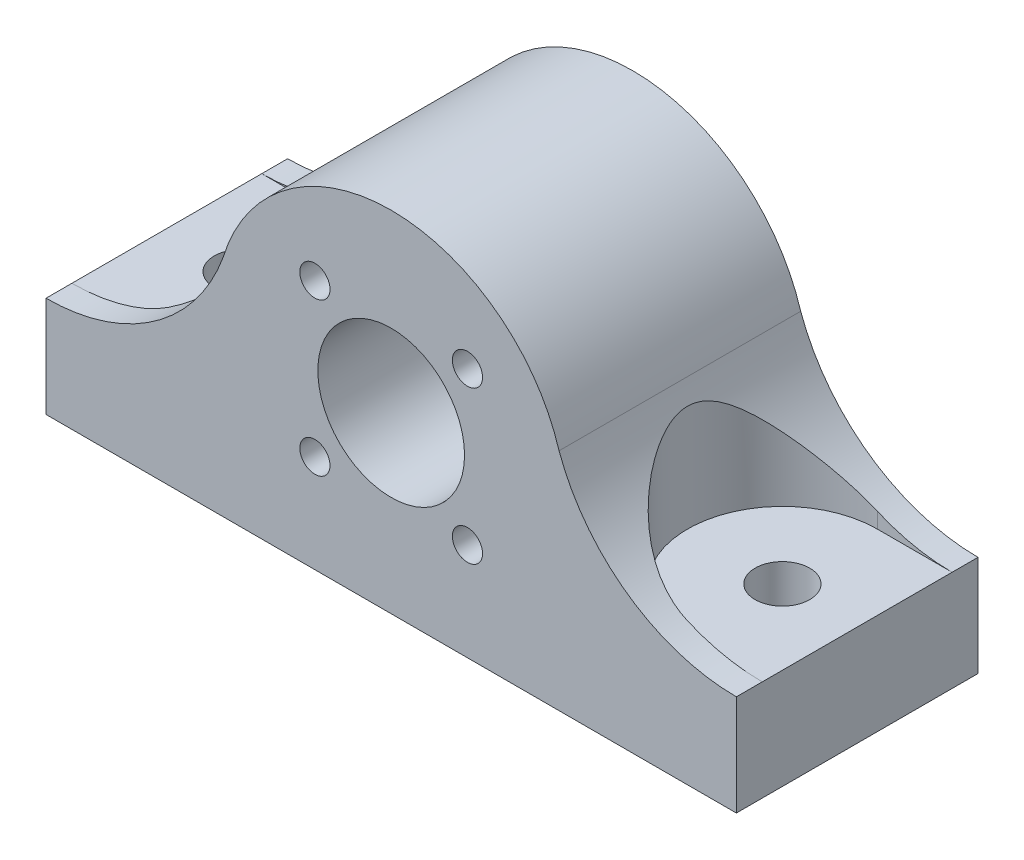
from build123d import *

# Parameters (mm, degrees)
CROQUIS2_R              = 5.1
SALIENTE_EXTRUIR1_DEPTH = 16.8
CROQUIS3_R              = 1.05
CORTAR_EXTRUIR1_DEPTH   = 35.02249256
CORTAR_EXTRUIR2_DEPTH   = 35.02249256
CROQUIS5_R              = 1.9
CORTAR_EXTRUIR3_DEPTH   = 35.02249268


with BuildPart() as part:
    # Croquis2 → Saliente-Extruir1 (new body)
    with BuildSketch(Plane.XY):
        with BuildLine():
            Line((24, 0), (24, -7))
            Line((24, -7), (-24, -7))
            Line((-24, -7), (-24, 0))
            ThreePointArc((-24, 0), (-16.47005876, 2.37821186), (-11.672082076, 8.65))
            ThreePointArc((-11.672082076, 8.65), (0, 17.3), (11.672082076, 8.65))
            ThreePointArc((11.672082076, 8.65), (16.47005876, 2.37821186), (24, 0))
        make_face()
        with Locations((0, 5.1)):
            Circle(CROQUIS2_R, mode=Mode.SUBTRACT)
    extrude(amount=SALIENTE_EXTRUIR1_DEPTH)

    # Croquis3 → Cortar-Extruir1 (cut, through all)
    with BuildSketch(Plane.XY.offset(16.8)):
        with Locations((5.303300859, 10.403300859)):
            Circle(CROQUIS3_R)
        with Locations((5.303300859, -0.203300859)):
            Circle(CROQUIS3_R)
        with Locations((-5.303300859, -0.203300859)):
            Circle(CROQUIS3_R)
        with Locations((-5.303300859, 10.403300859)):
            Circle(CROQUIS3_R)
    extrude(amount=-CORTAR_EXTRUIR1_DEPTH, mode=Mode.SUBTRACT)

    # Croquis4 → Cortar-Extruir2 (cut, through all)
    with BuildSketch(Plane(origin=(0, 0, 0), x_dir=(1, 0, 0), z_dir=(0, 1, 0))):
        with BuildLine():
            Line((-24, -1.8), (-24, -15))
            Line((-24, -15), (-18.8, -15))
            ThreePointArc((-18.8, -15), (-12.2, -8.4), (-18.8, -1.8))
            Line((-18.8, -1.8), (-24, -1.8))
        make_face()
        with BuildLine():
            Line((24, -15), (18.8, -15))
            ThreePointArc((18.8, -15), (12.2, -8.4), (18.8, -1.8))
            Line((18.8, -1.8), (24, -1.8))
            Line((24, -1.8), (24, -15))
        make_face()
    extrude(amount=CORTAR_EXTRUIR2_DEPTH, mode=Mode.SUBTRACT)

    # Croquis5 → Cortar-Extruir3 (cut, through all)
    with BuildSketch(Plane(origin=(0, 0, 0), x_dir=(1, 0, 0), z_dir=(0, 1, 0))):
        with Locations(Location((-18.8, -8.4, 0), (0, 0, 270))):
            Circle(CROQUIS5_R)
        with Locations(Location((18.8, -8.4, 0), (0, 0, 90))):
            Circle(CROQUIS5_R)
    extrude(amount=-CORTAR_EXTRUIR3_DEPTH, mode=Mode.SUBTRACT)


solid = part.part
